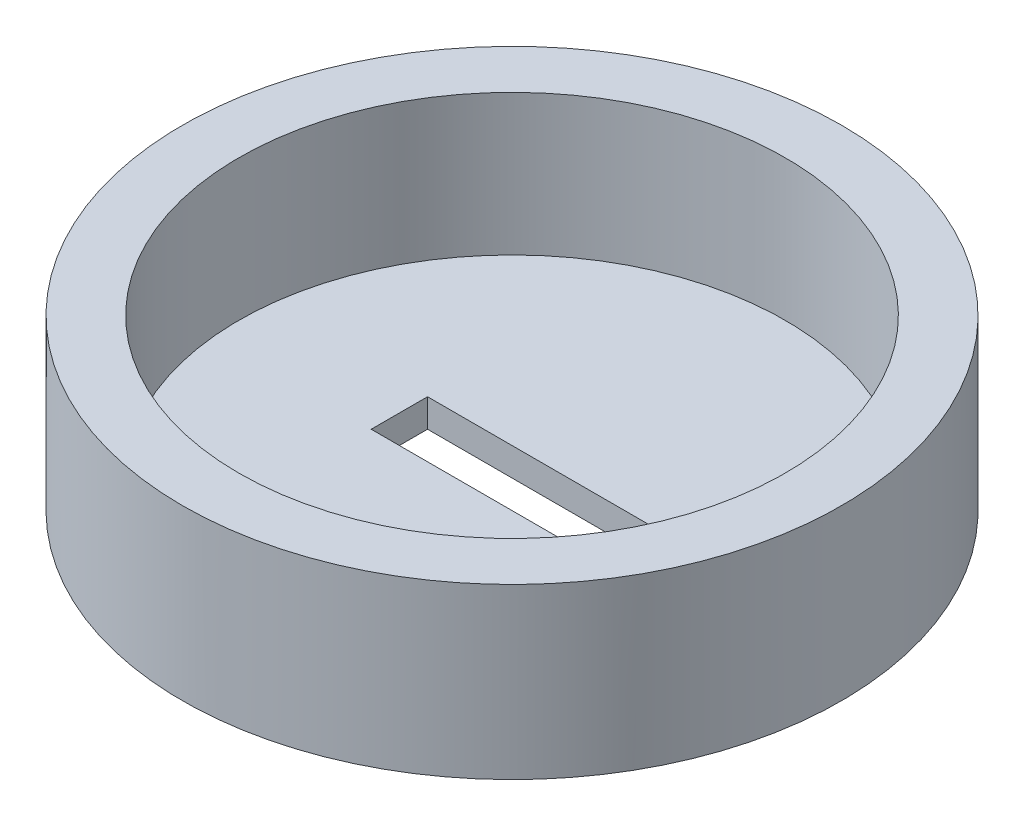
from build123d import *

# Parameters (mm, degrees)
SKETCH1_R           = 11.7
SKETCH1_R_2         = 9.7
BOSS_EXTRUDE1_DEPTH = 5
BOSS_EXTRUDE2_START = 1
SKETCH2_R           = 11.7
BOSS_EXTRUDE2_DEPTH = 1
SKETCH3_W           = 8
SKETCH3_H           = 2
CUT_EXTRUDE1_DEPTH  = 7


with BuildPart() as part:
    # Sketch1 → Boss-Extrude1 (new body)
    with BuildSketch(Plane(origin=(0, 0, 0), x_dir=(1, 0, 0), z_dir=(0, 1, 0))):
        with Locations(Location((0, 0, 0), (0, 0, 270))):
            Circle(SKETCH1_R)
        with Locations(Location((0, 0, 0), (0, 0, 270))):
            Circle(SKETCH1_R_2, mode=Mode.SUBTRACT)
    extrude(amount=BOSS_EXTRUDE1_DEPTH)

    # Sketch2 → Boss-Extrude2 (add)
    with BuildSketch(Plane.XZ.offset(BOSS_EXTRUDE2_START)):
        with Locations(Location((0, 0, 0), (0, 0, 270))):
            Circle(SKETCH2_R)
    extrude(amount=-BOSS_EXTRUDE2_DEPTH)

    # Sketch3 → Cut-Extrude1 (cut)
    with BuildSketch(Plane.XZ.offset(1)):
        Rectangle(SKETCH3_W, SKETCH3_H)
    extrude(amount=-CUT_EXTRUDE1_DEPTH, mode=Mode.SUBTRACT)


solid = part.part
